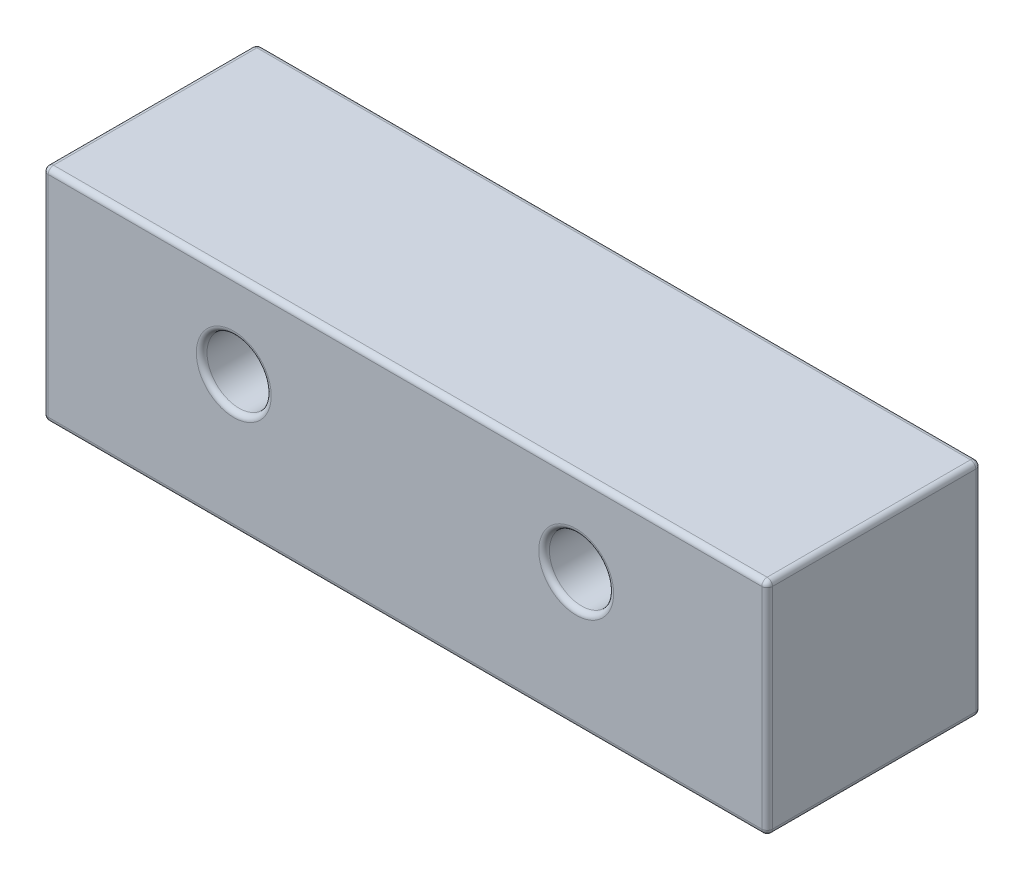
from build123d import *

# Parameters (mm, degrees)
SKETCH1_W           = 67.684274796
SKETCH1_H           = 20.635526277
SKETCH1_R           = 3
BOSS_EXTRUDE1_DEPTH = 20
FILLET1_R           = 0.5


with BuildPart() as part:
    # Sketch1 → Boss-Extrude1 (new body)
    with BuildSketch(Plane.XY):
        with Locations((-33.842137398, 10.317763139)):
            Rectangle(SKETCH1_W, SKETCH1_H)
        with Locations((-49.842137398, 12.635526277)):
            Circle(SKETCH1_R, mode=Mode.SUBTRACT)
        with Locations((-17.842137398, 12.635526277)):
            Circle(SKETCH1_R, mode=Mode.SUBTRACT)
    extrude(amount=BOSS_EXTRUDE1_DEPTH)

    # Fillet1
    fillet1_edges = [part.edges().sort_by_distance(p)[0] for p in [
        (-52.842137398, 12.635526277, 0),
        (-52.842137398, 12.635526277, 20),
        (-33.842137398, 20.635526277, 20),
        (-20.842137398, 12.635526277, 0),
        (-20.842137398, 12.635526277, 20),
        (-67.684274796, 10.317763139, 20),
        (-33.842137398, 0, 20),
        (-67.684274796, 10.317763139, 0),
        (-33.842137398, 20.635526277, 0),
        (0, 10.317763139, 0),
        (-33.842137398, 0, 0),
        (-67.684274796, 0, 10),
        (-67.684274796, 20.635526277, 10),
        (0, 20.635526277, 10),
        (0, 0, 10),
        (0, 10.317763139, 20),
    ]]
    fillet(fillet1_edges, radius=FILLET1_R)


solid = part.part
